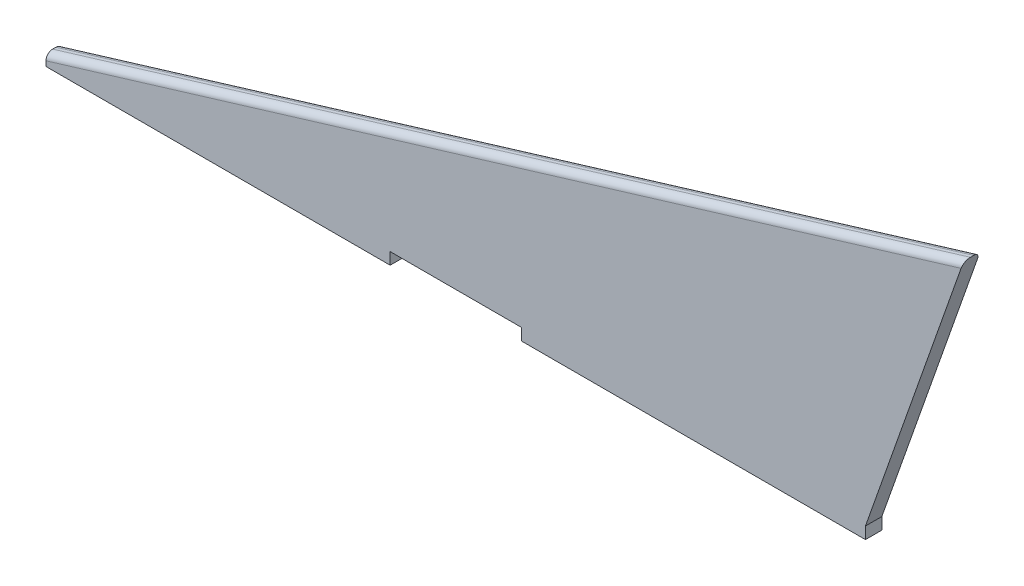
from build123d import *

# Parameters (mm, degrees)
BOSS_EXTRUDE1_DEPTH = 2.5
FILLET1_R           = 1


with BuildPart() as part:
    # Sketch1 → Boss-Extrude1 (new body)
    with BuildSketch(Plane.XY):
        Polygon((0, 0), (140, 42.5), (125, 0), (125, -1.8), (72.5, -1.8), (72.5, 0), (52.5, 0), (52.5, -1.8), (0, -1.8), align=None)
    extrude(amount=BOSS_EXTRUDE1_DEPTH)

    # Fillet1
    fillet1_edges = [part.edges().sort_by_distance(p)[0] for p in [
        (70, 21.25, 0),
        (70, 21.25, 2.5),
    ]]
    fillet(fillet1_edges, radius=FILLET1_R)


solid = part.part
